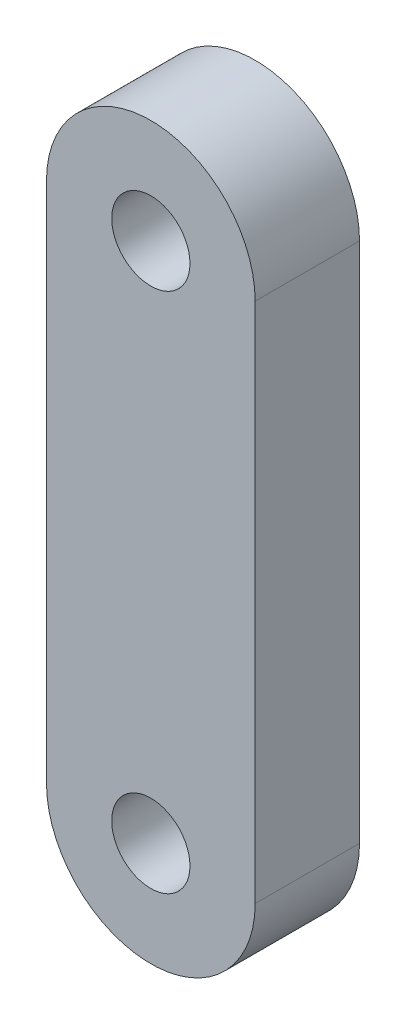
from build123d import *

# Parameters (mm, degrees)
SKETCH_1_R      = 1.5
EXTRUDE_1_DEPTH = 4


with BuildPart() as part:
    # 草图1 → 凸台-拉伸1 (new body)
    with BuildSketch(Plane.XY):
        with BuildLine():
            Line((4, 10.838926174), (4, -9.161073826))
            ThreePointArc((4, -9.161073826), (0, -13.161073826), (-4, -9.161073826))
            Line((-4, -9.161073826), (-4, 10.838926174))
            ThreePointArc((-4, 10.838926174), (0, 14.838926174), (4, 10.838926174))
        make_face()
        with Locations((0, 10.838926174)):
            Circle(SKETCH_1_R, mode=Mode.SUBTRACT)
        with Locations((0, -9.161073826)):
            Circle(SKETCH_1_R, mode=Mode.SUBTRACT)
    extrude(amount=EXTRUDE_1_DEPTH)


solid = part.part
